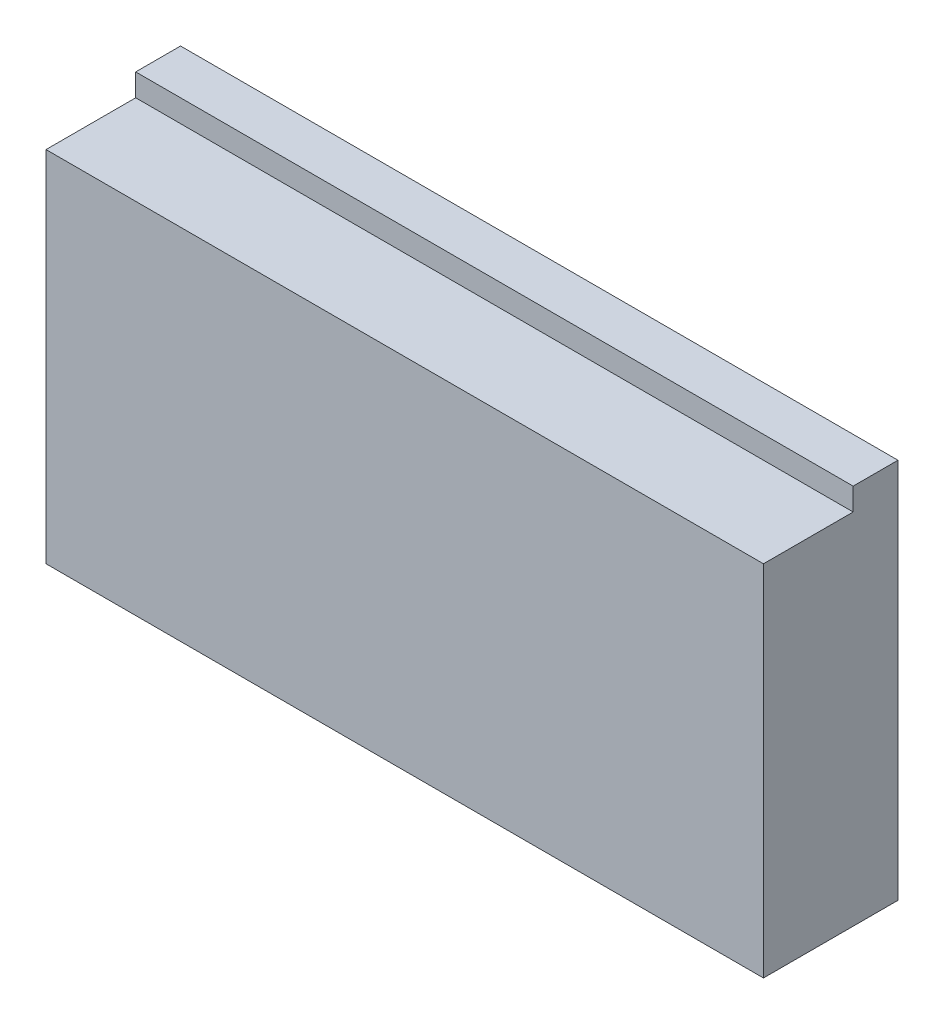
from build123d import *

# Parameters (mm, degrees)
BASE_W             = 32
BASE_H             = 6
BOSS_EXTRU_1_DEPTH = 16
ESQUISSE2_W        = 32
ESQUISSE2_H        = 2
BOSS_EXTRU_2_DEPTH = 1


with BuildPart() as part:
    # Base → Boss.-Extru.1 (new body)
    with BuildSketch(Plane(origin=(0, 0, 0), x_dir=(1, 0, 0), z_dir=(0, 1, 0))):
        with Locations((16, 3)):
            Rectangle(BASE_W, BASE_H)
    extrude(amount=BOSS_EXTRU_1_DEPTH)

    # Esquisse2 → Boss.-Extru.2 (add)
    with BuildSketch(Plane(origin=(0, 16, 0), x_dir=(1, 0, 0), z_dir=(0, 1, 0))):
        with Locations((16, 5)):
            Rectangle(ESQUISSE2_W, ESQUISSE2_H)
    extrude(amount=BOSS_EXTRU_2_DEPTH)


solid = part.part
